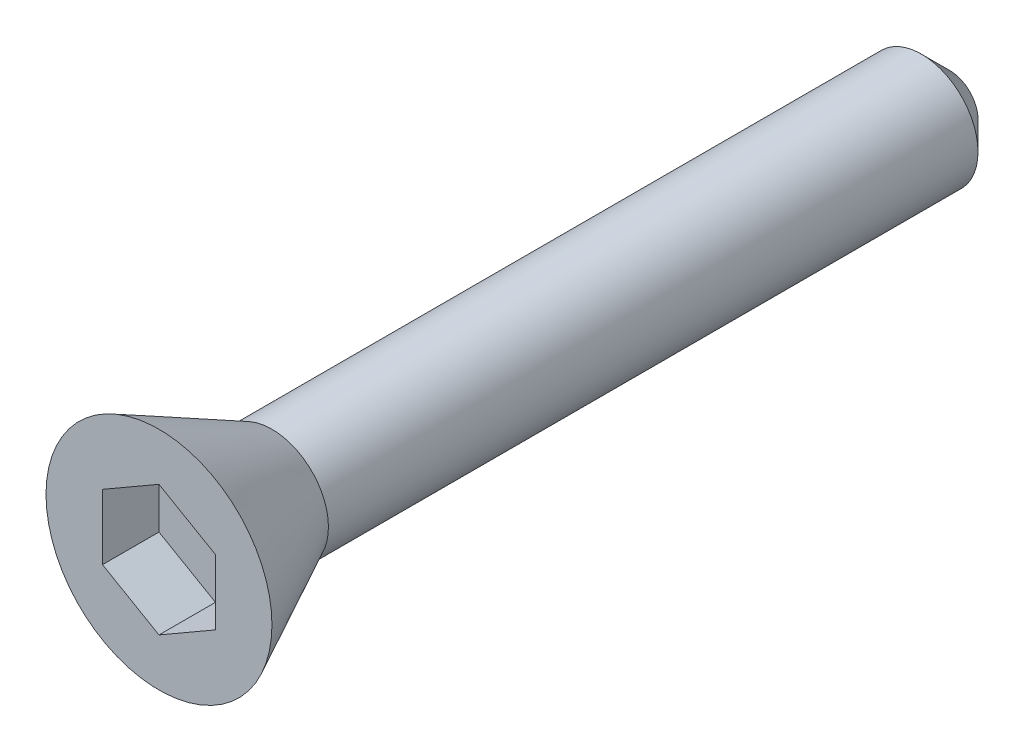
from build123d import *

# Parameters (mm, degrees)
FOOTPRINT_DEPTH = 1
CHAMFER1_SIZE   = 0.5


with BuildPart() as part:
    # Sketch1 → Body (revolve)
    with BuildSketch(Plane(origin=(0, 0, 0), x_dir=(0, 0, -1), z_dir=(1, 0, 0)), mode=Mode.PRIVATE) as body_sk:
        Polygon((0, 0), (0, 2), (2, 1), (14, 1), (14, 0), align=None)
    revolve(body_sk.sketch.rotate(Axis((0, 0, 58.51474448), (0, 0, -1)), 90), axis=Axis((0, 0, 58.51474448), (0, 0, -1)))

    # Sketch2 → Footprint (cut)
    with BuildSketch(Plane.XY):
        Polygon((0, 1.154700538), (-1, 0.577350269), (-1, -0.577350269), (0, -1.154700538), (1, -0.577350269), (1, 0.577350269), align=None)
    extrude(amount=-FOOTPRINT_DEPTH, mode=Mode.SUBTRACT)

    # Chamfer1
    chamfer1_edges = [part.edges().sort_by_distance(p)[0] for p in [
        (-1, 0, -14),
    ]]
    chamfer(chamfer1_edges, length=CHAMFER1_SIZE)


solid = part.part
